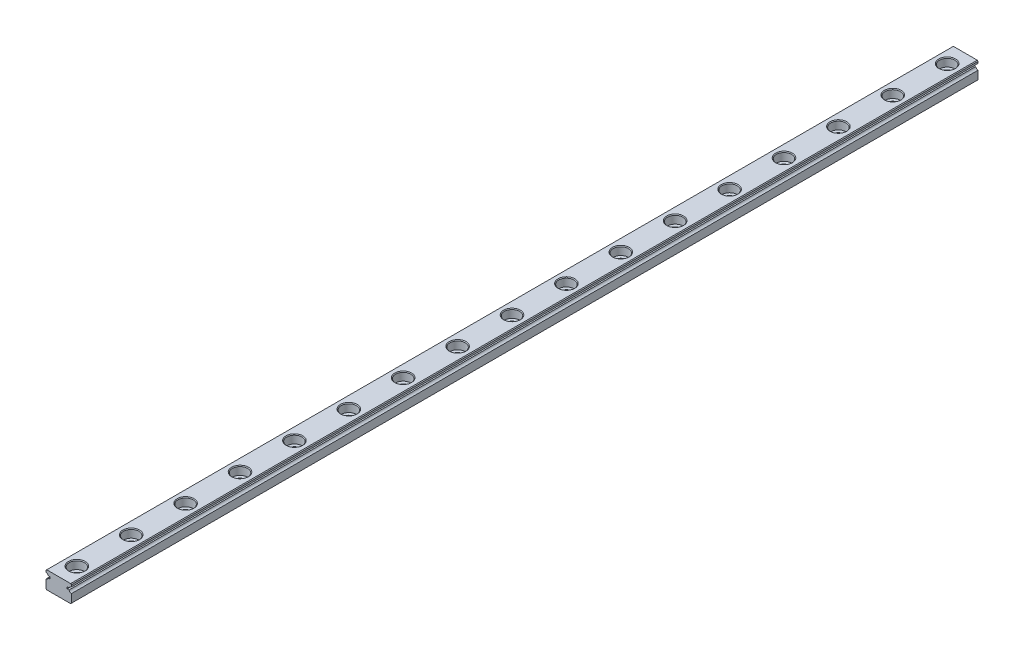
from build123d import *

# Parameters (mm, degrees)
EXTRUDE1_DEPTH             = 250
EXTRUDE2_REACH             = 252.071
SKETCH2_R                  = 1.2
SKETCH_R                   = 2.1
SKETCH_R_2                 = 1.2
EXTRUDE4_DEPTH             = 2.3
CHAMFER1_SIZE              = 0.2
LPATTERN1_COUNT            = 17
LPATTERN1_PITCH            = 15
CHAMFER1_OF_LPATTERN1_SIZE = 0.2


with BuildPart() as part:
    # Sketch1 → Extrude1 (new body)
    with BuildSketch(Plane.XY):
        with BuildLine():
            Line((-3.3, -2.4), (3.3, -2.4))
            Line((3.3, -2.4), (3.5, -2.2))
            Line((3.5, -2.2), (3.5, 0.106274607))
            ThreePointArc((3.5, 0.106274607), (3.091294745, 0.282570681), (2.840065792, 0.65))
            Line((2.840065792, 0.65), (2.340065792, 0.65))
            Line((2.340065792, 0.65), (2.340065792, 1.15))
            Line((2.340065792, 1.15), (2.840065792, 1.15))
            ThreePointArc((2.840065792, 1.15), (3.091294745, 1.517429319), (3.5, 1.693725393))
            Line((3.5, 1.693725393), (3.5, 2.2))
            Line((3.5, 2.2), (3.3, 2.4))
            Line((3.3, 2.4), (-3.3, 2.4))
            Line((-3.3, 2.4), (-3.5, 2.2))
            Line((-3.5, 2.2), (-3.5, 1.693725393))
            ThreePointArc((-3.5, 1.693725393), (-3.091294745, 1.517429319), (-2.840065792, 1.15))
            Line((-2.840065792, 1.15), (-2.340065792, 1.15))
            Line((-2.340065792, 1.15), (-2.340065792, 0.65))
            Line((-2.340065792, 0.65), (-2.840065792, 0.65))
            ThreePointArc((-2.840065792, 0.65), (-3.091294745, 0.282570681), (-3.5, 0.106274607))
            Line((-3.5, 0.106274607), (-3.5, -2.2))
            Line((-3.5, -2.2), (-3.3, -2.4))
        make_face()
    extrude(amount=EXTRUDE1_DEPTH)

    # Sketch2 → Extrude2 (cut, up to next)
    with BuildSketch(Plane(origin=(0, 2.4, 0), x_dir=(1, 0, 0), z_dir=(0, 1, 0)), mode=Mode.PRIVATE) as extrude2_sk1:
        with Locations(Location((0, -5, 0), (0, 0, 270))):
            Circle(SKETCH2_R)
    extrude2_tool1 = extrude(extrude2_sk1.sketch, amount=-EXTRUDE2_REACH, mode=Mode.PRIVATE) & part.part
    extrude2 = extrude2_tool1.solids().sort_by_distance((0, 2.4, 5))[0]
    add(extrude2, mode=Mode.SUBTRACT)

    # Sketch → Extrude4 (cut)
    with BuildSketch(Plane(origin=(0, 2.4, 0), x_dir=(1, 0, 0), z_dir=(0, 1, 0))):
        with Locations(Location((0, -5, 0), (0, 0, 270))):
            Circle(SKETCH_R)
        with Locations(Location((0, -5, 0), (0, 0, 270))):
            Circle(SKETCH_R_2, mode=Mode.SUBTRACT)
    extrude4 = extrude(amount=-EXTRUDE4_DEPTH, mode=Mode.SUBTRACT)

    # Chamfer1
    chamfer1_edges = [part.edges().sort_by_distance(p)[0] for p in [
        (0, -2.4, 3.8),
        (0, 2.4, 2.9),
    ]]
    chamfer(chamfer1_edges, length=CHAMFER1_SIZE)

    # LPattern1: Extrude2, Extrude4 ×17
    with Locations(*[(0, 0, i * LPATTERN1_PITCH) for i in range(1, LPATTERN1_COUNT)]):
        add(extrude2, mode=Mode.SUBTRACT)
        add(extrude4, mode=Mode.SUBTRACT)

    # Chamfer1 of LPattern1
    chamfer1_of_lpattern1_edges = [part.edges().sort_by_distance(p)[0] for p in [
        (0, -2.4, 18.8),
        (0, 2.4, 17.9),
        (0, -2.4, 33.8),
        (0, 2.4, 32.9),
        (0, -2.4, 48.8),
        (0, 2.4, 47.9),
        (0, -2.4, 63.8),
        (0, 2.4, 62.9),
        (0, -2.4, 78.8),
        (0, 2.4, 77.9),
        (0, -2.4, 93.8),
        (0, 2.4, 92.9),
        (0, -2.4, 108.8),
        (0, 2.4, 107.9),
        (0, -2.4, 123.8),
        (0, 2.4, 122.9),
        (0, -2.4, 138.8),
        (0, 2.4, 137.9),
        (0, -2.4, 153.8),
        (0, 2.4, 152.9),
        (0, -2.4, 168.8),
        (0, 2.4, 167.9),
        (0, -2.4, 183.8),
        (0, 2.4, 182.9),
        (0, -2.4, 198.8),
        (0, 2.4, 197.9),
        (0, -2.4, 213.8),
        (0, 2.4, 212.9),
        (0, -2.4, 228.8),
        (0, 2.4, 227.9),
        (0, -2.4, 243.8),
        (0, 2.4, 242.9),
    ]]
    chamfer(chamfer1_of_lpattern1_edges, length=CHAMFER1_OF_LPATTERN1_SIZE)


solid = part.part
